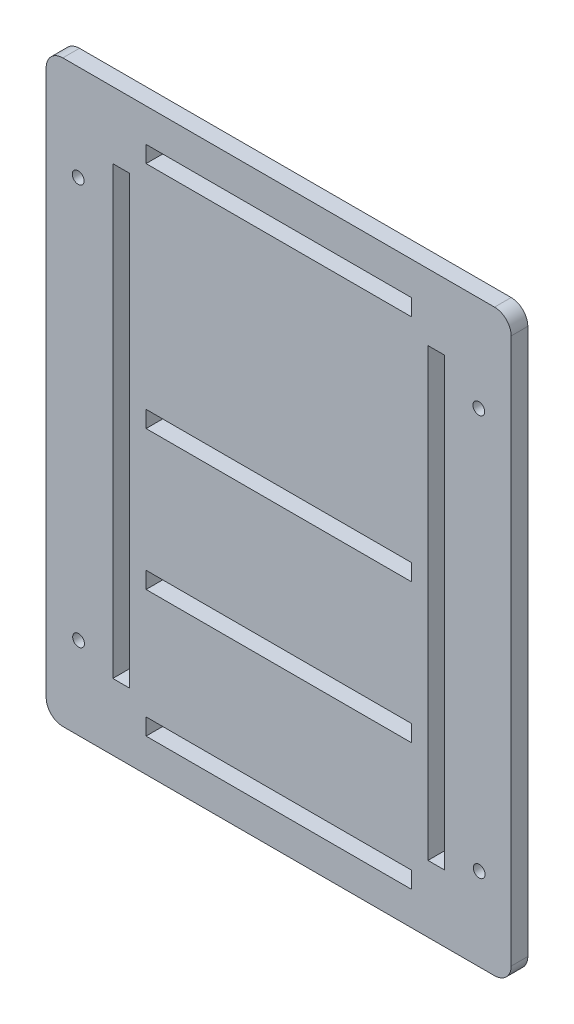
from build123d import *

# Parameters (mm, degrees)
SKETCH1_W             = 101.1682
SKETCH1_H             = 6.35
SKETCH1_W_2           = 6.35
SKETCH1_H_2           = 170.072742275
BOSS_EXTRUDE1_DEPTH   = 6.35
F_8_CLEARANCE_HOLE1_D = 4.4958


with BuildPart() as part:
    # Sketch1 → Boss-Extrude1 (new body)
    with BuildSketch(Plane.XY):
        with BuildLine():
            Line((25.4, -12.7), (-139.2682, -12.7))
            ThreePointArc((-139.2682, -12.7), (-143.758328061, -10.840128061), (-145.6182, -6.35))
            Line((-145.6182, -6.35), (-145.6182, 201.822742275))
            ThreePointArc((-145.6182, 201.822742275), (-143.758328061, 206.312870335), (-139.2682, 208.172742275))
            Line((-139.2682, 208.172742275), (25.4, 208.172742275))
            ThreePointArc((25.4, 208.172742275), (29.890128061, 206.312870335), (31.75, 201.822742275))
            Line((31.75, 201.822742275), (31.75, -6.35))
            ThreePointArc((31.75, -6.35), (29.890128061, -10.840128061), (25.4, -12.7))
        make_face()
        with Locations((-56.9341, 192.297742275)):
            Rectangle(SKETCH1_W, SKETCH1_H, mode=Mode.SUBTRACT)
        with Locations((3.175, 97.736371138)):
            Rectangle(SKETCH1_W_2, SKETCH1_H_2, mode=Mode.SUBTRACT)
        with Locations((-117.0432, 97.736371138)):
            Rectangle(SKETCH1_W_2, SKETCH1_H_2, mode=Mode.SUBTRACT)
        with Locations((-56.9341, 104.775)):
            Rectangle(SKETCH1_W, SKETCH1_H, mode=Mode.SUBTRACT)
        with Locations((-56.9341, 3.175)):
            Rectangle(SKETCH1_W, SKETCH1_H, mode=Mode.SUBTRACT)
        with Locations((-56.9341, 51.6128)):
            Rectangle(SKETCH1_W, SKETCH1_H, mode=Mode.SUBTRACT)
    extrude(amount=BOSS_EXTRUDE1_DEPTH)

    # #8 Clearance Hole1 (through all)
    with Locations(Plane(origin=(-70.641043598, 181.536765785, 9.525), x_dir=(-1, 0, 0), z_dir=(0, 0, 1))):
        with Locations((62.625233431, 162.765803656), (62.772094273, 9.954588756), (-90.039120627, 9.807727914), (-90.185981469, 162.618942814)):
            Hole(F_8_CLEARANCE_HOLE1_D / 2)


solid = part.part
